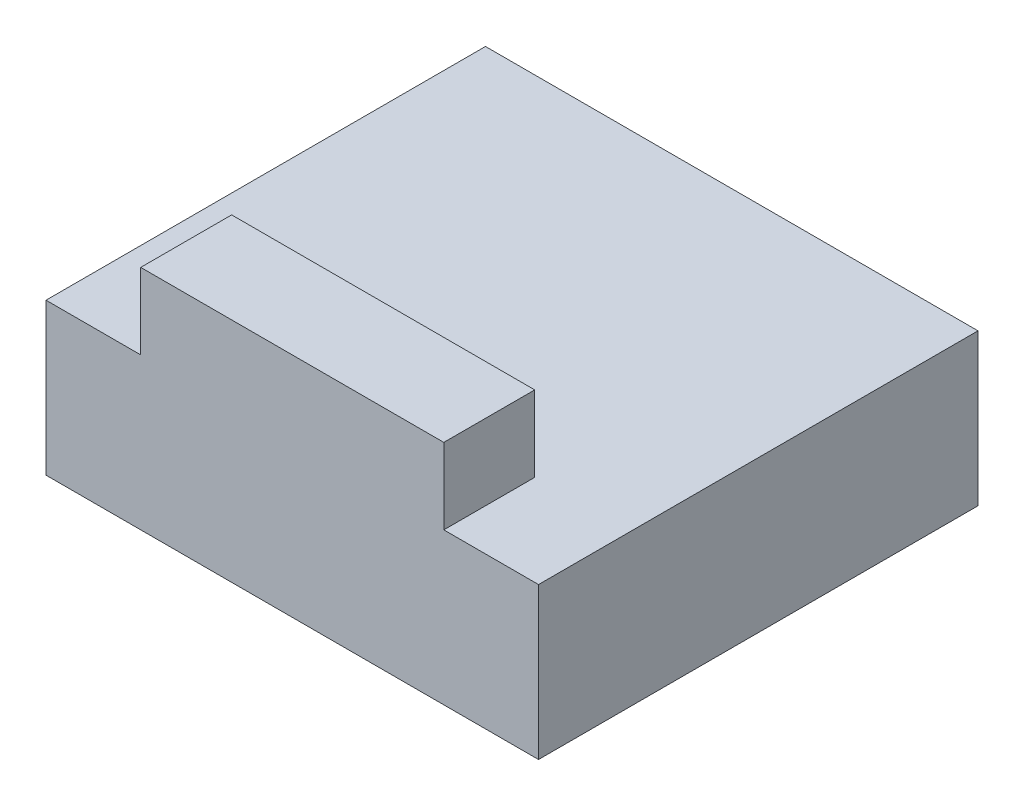
from build123d import *

# Parameters (mm, degrees)
SKETCH1_W           = 65
SKETCH1_H           = 58
BOSS_EXTRUDE1_DEPTH = 20
SKETCH2_W           = 40
SKETCH2_H           = 12
BOSS_EXTRUDE2_DEPTH = 30


with BuildPart() as part:
    # Sketch1 → Boss-Extrude1 (new body)
    with BuildSketch(Plane(origin=(0, 0, 0), x_dir=(1, 0, 0), z_dir=(0, 1, 0))):
        Rectangle(SKETCH1_W, SKETCH1_H)
    extrude(amount=BOSS_EXTRUDE1_DEPTH)

    # Sketch2 → Boss-Extrude2 (add)
    with BuildSketch(Plane.XZ):
        with Locations((0, 23)):
            Rectangle(SKETCH2_W, SKETCH2_H)
    extrude(amount=-BOSS_EXTRUDE2_DEPTH)


solid = part.part
